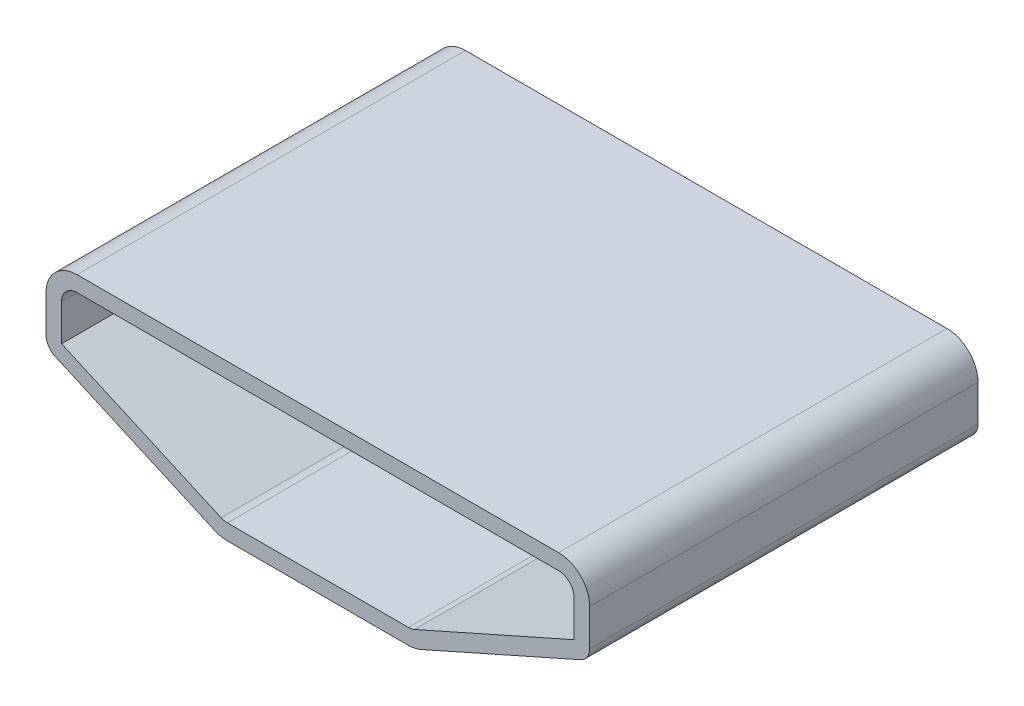
from build123d import *

# Parameters (mm, degrees)
BOSS_EXTRUDE2_DEPTH = 5
BOSS_EXTRUDE3_DEPTH = 0.5


with BuildPart() as part:
    # Sketch1 → Boss-Extrude2 (new body)
    with BuildSketch(Plane.XY):
        with BuildLine():
            Line((-5.525095111, -0.448623985), (-5.525095111, 0.021401397))
            ThreePointArc((-5.525095111, 0.021401397), (-5.407937823, 0.304244109), (-5.125095111, 0.421401397))
            Line((-5.125095111, 0.421401397), (1.074904889, 0.421401397))
            ThreePointArc((1.074904889, 0.421401397), (1.357747601, 0.304244109), (1.474904889, 0.021401397))
            Line((1.474904889, 0.021401397), (1.474904889, -0.448623985))
            ThreePointArc((1.474904889, -0.448623985), (1.442603337, -0.557606693), (1.356132582, -0.631386295))
            Line((1.356132582, -0.631386295), (-0.697525505, -1.544123223))
            ThreePointArc((-0.697525505, -1.544123223), (-0.776944296, -1.569884846), (-0.859980891, -1.578598603))
            Line((-0.859980891, -1.578598603), (-3.190209331, -1.578598603))
            ThreePointArc((-3.190209331, -1.578598603), (-3.273245926, -1.569884846), (-3.352664717, -1.544123223))
            Line((-3.352664717, -1.544123223), (-5.406322804, -0.631386295))
            ThreePointArc((-5.406322804, -0.631386295), (-5.492793559, -0.557606693), (-5.525095111, -0.448623985))
        make_face()
        with BuildLine():
            Line((-0.778753198, -1.361360913), (1.274904889, -0.448623985))
            Line((1.274904889, -0.448623985), (1.274904889, 0.021401397))
            ThreePointArc((1.274904889, 0.021401397), (1.216326245, 0.162822753), (1.074904889, 0.221401397))
            Line((1.074904889, 0.221401397), (-5.125095111, 0.221401397))
            ThreePointArc((-5.125095111, 0.221401397), (-5.266516467, 0.162822753), (-5.325095111, 0.021401397))
            Line((-5.325095111, 0.021401397), (-5.325095111, -0.448623985))
            Line((-5.325095111, -0.448623985), (-3.271437024, -1.361360913))
            ThreePointArc((-3.271437024, -1.361360913), (-3.231727628, -1.374241725), (-3.190209331, -1.378598603))
            Line((-3.190209331, -1.378598603), (-0.859980891, -1.378598603))
            ThreePointArc((-0.859980891, -1.378598603), (-0.818462594, -1.374241725), (-0.778753198, -1.361360913))
        make_face(mode=Mode.SUBTRACT)
    extrude(amount=BOSS_EXTRUDE2_DEPTH)

    # Sketch2 → Boss-Extrude3 (add)
    with BuildSketch(Plane.XY):
        with BuildLine():
            Line((-3.190209331, -1.378598603), (-0.859980891, -1.378598603))
            ThreePointArc((-0.859980891, -1.378598603), (-0.818462594, -1.374241725), (-0.778753198, -1.361360913))
            Line((-0.778753198, -1.361360913), (1.274904889, -0.448623985))
            Line((1.274904889, -0.448623985), (1.274904889, 0.304244109))
            Line((1.274904889, 0.304244109), (-5.407937823, 0.304244109))
            Line((-5.407937823, 0.304244109), (-5.407937823, -0.448623985))
            Line((-5.407937823, -0.448623985), (-5.325095111, -0.448623985))
            Line((-5.325095111, -0.448623985), (-3.271437024, -1.361360913))
            ThreePointArc((-3.271437024, -1.361360913), (-3.231727628, -1.374241725), (-3.190209331, -1.378598603))
        make_face()
    extrude(amount=BOSS_EXTRUDE3_DEPTH)


solid = part.part
